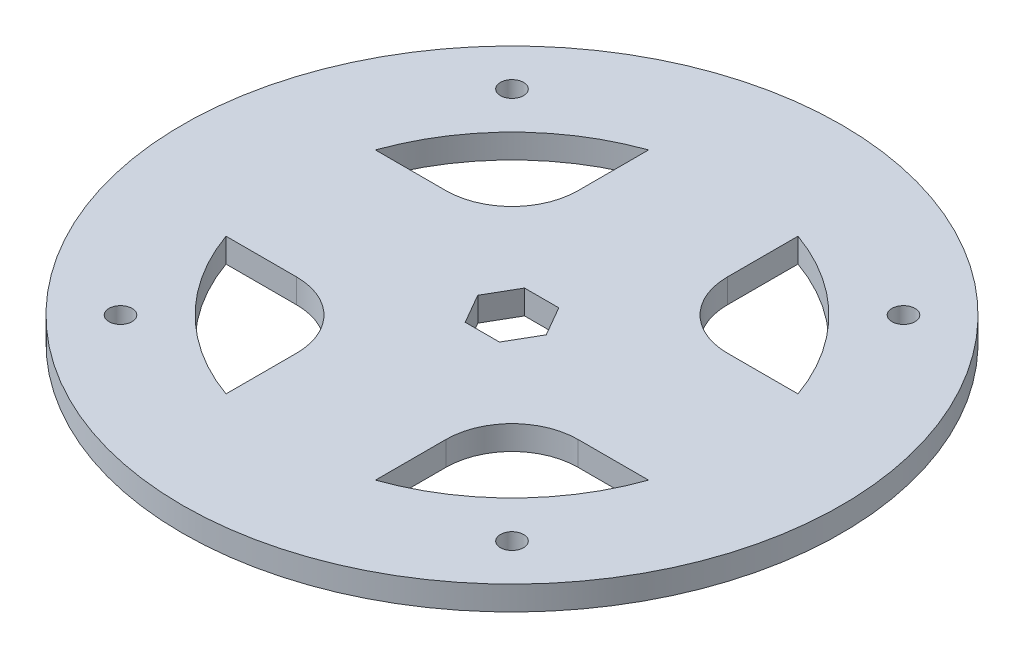
from build123d import *

# Parameters (mm, degrees)
SKETCH1_R           = 75
SKETCH1_R_2         = 4.25
BOSS_EXTRUDE1_DEPTH = 5.5
SKETCH4_R           = 2.625
CUT_EXTRUDE2_DEPTH  = 5.5
CUT_EXTRUDE3_DEPTH  = 5.5


with BuildPart() as part:
    # Sketch1 → Boss-Extrude1 (new body)
    with BuildSketch(Plane(origin=(0, 0, 0), x_dir=(1, 0, 0), z_dir=(0, 1, 0))):
        with Locations(Location((0, 0, 0), (0, 0, 270))):
            Circle(SKETCH1_R)
        with Locations(Location((0, 0, 0), (0, 0, 270))):
            Circle(SKETCH1_R_2, mode=Mode.SUBTRACT)
    extrude(amount=BOSS_EXTRUDE1_DEPTH)

    # Sketch4 → Cut-Extrude2 (cut)
    with BuildSketch(Plane(origin=(0, 5.5, 0), x_dir=(1, 0, 0), z_dir=(0, 1, 0))):
        with Locations(Location((44.547727215, -44.547727215, 0), (0, 0, 270))):
            Circle(SKETCH4_R)
        with Locations(Location((-44.547727215, -44.547727215, 0), (0, 0, 270))):
            Circle(SKETCH4_R)
        with Locations(Location((44.547727215, 44.547727215, 0), (0, 0, 270))):
            Circle(SKETCH4_R)
        with Locations(Location((-44.547727215, 44.547727215, 0), (0, 0, 270))):
            Circle(SKETCH4_R)
        Polygon((7.794228634, 0), (3.897114317, 6.75), (-3.897114317, 6.75), (-7.794228634, 0), (-3.897114317, -6.75), (3.897114317, -6.75), align=None)
    extrude(amount=-CUT_EXTRUDE2_DEPTH, mode=Mode.SUBTRACT)

    # Sketch5 → Cut-Extrude3 (cut)
    with BuildSketch(Plane(origin=(0, 5.5, 0), x_dir=(1, 0, 0), z_dir=(0, 1, 0))):
        with BuildLine():
            Line((32, -17), (48.083261121, -17))
            ThreePointArc((48.083261121, -17), (36.062445841, -36.062445841), (17, -48.083261121))
            Line((17, -48.083261121), (17, -32))
            ThreePointArc((17, -32), (21.393398282, -21.393398282), (32, -17))
        make_face()
        with BuildLine():
            Line((-17, -32), (-17, -48.083261121))
            ThreePointArc((-17, -48.083261121), (-36.062445841, -36.062445841), (-48.083261121, -17))
            Line((-48.083261121, -17), (-32, -17))
            ThreePointArc((-32, -17), (-21.393398282, -21.393398282), (-17, -32))
        make_face()
        with BuildLine():
            Line((17, 32), (17, 48.083261121))
            ThreePointArc((17, 48.083261121), (36.062445841, 36.062445841), (48.083261121, 17))
            Line((48.083261121, 17), (32, 17))
            ThreePointArc((32, 17), (21.393398282, 21.393398282), (17, 32))
        make_face()
        with BuildLine():
            Line((-32, 17), (-48.083261121, 17))
            ThreePointArc((-48.083261121, 17), (-36.062445841, 36.062445841), (-17, 48.083261121))
            Line((-17, 48.083261121), (-17, 32))
            ThreePointArc((-17, 32), (-21.393398282, 21.393398282), (-32, 17))
        make_face()
    extrude(amount=-CUT_EXTRUDE3_DEPTH, mode=Mode.SUBTRACT)


solid = part.part
